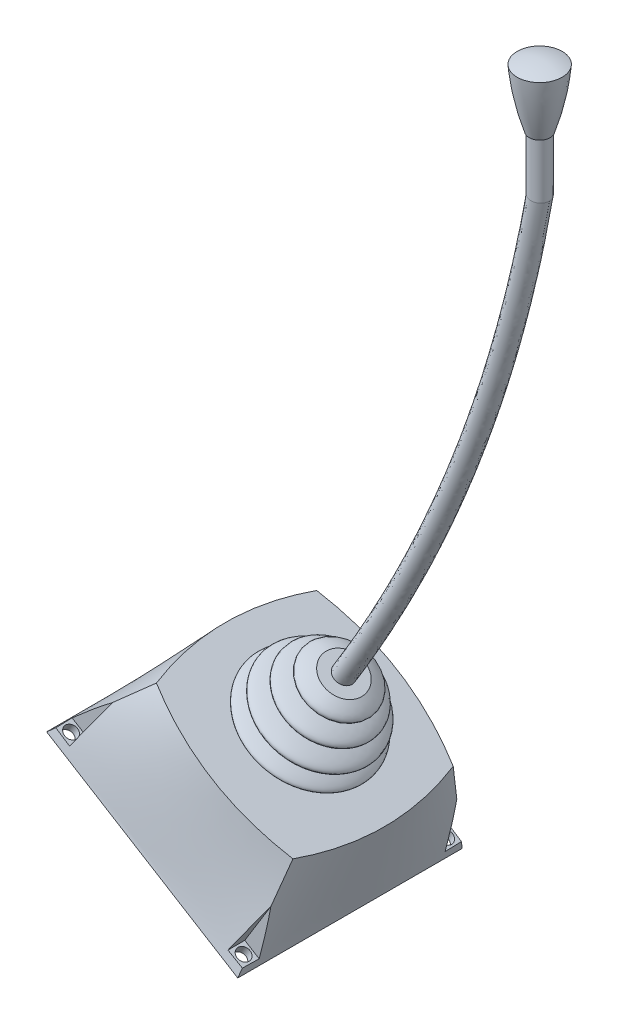
from build123d import *

# Parameters (mm, degrees)
SKETCH2_R          = 15
SKETCH10_W         = 30
SKETCH10_H         = 30
CUT_EXTRUDE1_DEPTH = 137.5
SKETCH12_W         = 10
SKETCH12_H         = 100
CIRPATTERN2_COUNT  = 4
SCALE2_SCALE       = 0.7


with BuildPart() as part:
    # Sweep1: sweep along a path in Sketch1
    with BuildLine() as sweep1_path:  # in the path sketch's own coordinates; laid on its plane below (add() does not lay a ready-made edge on the line's plane)
        Line((0, 25.731237744), (0, -89.384683846))
        add(Edge.make_bspline(
            [(0, -89.384683846), (-76.619317519, -517.816197766), (-305.28232105, -889.384683846)],
            knots=[0, 0, 0, 1, 1, 1], degree=2))
    # Sketch2 → Sweep1 (sweep)
    with BuildSketch(Plane(origin=(0, 25.731237744, 0), x_dir=(1, 0, 0), z_dir=(0, 1, 0))):
        Circle(SKETCH2_R)
    sweep(path=Plane.XY * sweep1_path.line, transition=Transition.RIGHT)

    # Sketch6 → Revolve4 (revolve)
    with BuildSketch(Plane.XY):
        with BuildLine():
            Line((-305.28232105, -889.384683846), (-277.675722749, -906.373766402))
            add(Edge.make_bspline(
                [(-277.675722749, -906.373766402), (-249.070910555, -940.147602219), (-289.199287868, -930.690561742)],
                knots=[0, 0, 0, 1, 1, 1], degree=2))
            add(Edge.make_bspline(
                [(-289.199287868, -930.690561742), (-239.648861973, -972.670827058), (-293.814928413, -963.230827581)],
                knots=[0, 0, 0, 1, 1, 1], degree=2))
            add(Edge.make_bspline(
                [(-293.814928413, -963.230827581), (-242.591086587, -1007.107299785), (-294.968838549, -997.38656761)],
                knots=[0, 0, 0, 1, 1, 1], degree=2))
            add(Edge.make_bspline(
                [(-294.968838549, -997.38656761), (-243.105190588, -1051.288372841), (-318.370546703, -1013.714881987), (-331.663180878, -1009.84879708)],
                knots=[0, 0, 0, 0, 1, 1, 1, 1], degree=3))
            Line((-331.663180878, -1009.84879708), (-366.298787064, -988.534067666))
            Line((-366.298787064, -988.534067666), (-305.28232105, -889.384683846))
        make_face()
    revolve(axis=Axis((-305.28232105, -889.384683846, 0), (-0.5241065254030228, -0.8516527167983265, 0)))

    # Sketch9 → Loft1 section 0
    with BuildSketch(Plane(origin=(-620.472581818, -1008.243809973, 0), x_dir=(-0.8516527167983268, 0.5241065254030226, 0), z_dir=(-0.5241065254030226, -0.8516527167983268, 0))):
        with BuildLine():
            Line((-381.137798284, 175), (-31.137798284, 175))
            Line((-31.137798284, 175), (-31.137798284, -175))
            Line((-31.137798284, -175), (-381.137798284, -175))
            Line((-381.137798284, -175), (-381.137798284, 175))
        make_face()
    # Sketch7 → Loft1 section 1
    with BuildSketch(Plane(origin=(-541.856603007, -880.495902453, 0), x_dir=(0.8516527167983268, -0.5241065254030226, 0), z_dir=(-0.5241065254030226, -0.8516527167983268, 0))):
        with BuildLine():
            add(Edge.make_bspline(
                [(81.137798284, 125), (206.137798284, 165.832368504), (331.137798284, 125)],
                knots=[0, 0, 0, 1, 1, 1], degree=2))
            add(Edge.make_bspline(
                [(331.137798284, 125), (371.970166789, 0), (331.137798284, -125)],
                knots=[0, 0, 0, 1, 1, 1], degree=2))
            add(Edge.make_bspline(
                [(331.137798284, -125), (206.137798284, -165.832368504), (81.137798284, -125)],
                knots=[0, 0, 0, 1, 1, 1], degree=2))
            add(Edge.make_bspline(
                [(81.137798284, -125), (40.30542978, 0), (81.137798284, 125)],
                knots=[0, 0, 0, 1, 1, 1], degree=2))
        make_face()
    loft()

    # Sketch10 → Cut-Extrude1 (cut)
    with BuildSketch(Plane(origin=(-541.856603007, -880.495902453, 0), x_dir=(0.8516527167983269, -0.5241065254030225, 0), z_dir=(0.5241065254030224, 0.8516527167983268, 0))):
        with Locations((366.137798284, 160)):
            Rectangle(SKETCH10_W, SKETCH10_H)
        with Locations((46.137798284, 160)):
            Rectangle(SKETCH10_W, SKETCH10_H)
        with Locations((46.137798284, -160)):
            Rectangle(SKETCH10_W, SKETCH10_H)
        with Locations((366.137798284, -160)):
            Rectangle(SKETCH10_W, SKETCH10_H)
    extrude(amount=-CUT_EXTRUDE1_DEPTH, mode=Mode.SUBTRACT)

    # Sketch12 → Hole1 (revolve, cut)
    with BuildSketch(Plane(origin=(-303.803034153, -1188.444698552, 157.9991439), x_dir=(-0.8516527167983265, 0.5241065254030227, 0), z_dir=(0, 0, 1))):
        with Locations((5, 50)):
            Rectangle(SKETCH12_W, SKETCH12_H)
    hole1 = revolve(axis=Axis((-361.454751948, -1282.126497399, 157.9991439), (0.5241065254030226, 0.8516527167983267, 0)), mode=Mode.SUBTRACT)

    # CirPattern2: Hole1 ×4 about axis
    cirpattern2_axis = Axis((175.557815944, -108.038165213, 0), (0.5241065254030227, 0.8516527167983265, 0))
    for i in range(1, CIRPATTERN2_COUNT):
        add(hole1.rotate(cirpattern2_axis, i * 360 / CIRPATTERN2_COUNT), mode=Mode.SUBTRACT)


with BuildPart() as body_2:
    # Sketch4 → Revolve3 (revolve)
    with BuildSketch(Plane.XY, mode=Mode.PRIVATE) as revolve3_sk:
        with BuildLine():
            add(Edge.make_bspline(
                [(0, 92.562829817), (17.5, 92.562829817), (35, 86.602143734)],
                knots=[0.5, 0.5, 0.5, 1, 1, 1], degree=2))
            add(Edge.make_bspline(
                [(16.496331619, -4.258044121), (31.065771721, 40.106678991), (35, 86.602143734)],
                knots=[0, 0, 0, 1, 1, 1], degree=2))
            Line((16.496331619, -4.258044121), (0, -4.258044121))
            Line((0, -4.258044121), (0, 92.562829817))
        make_face()
    revolve(revolve3_sk.sketch.rotate(Axis((0, 92.562829817, 0), (0, -1, 0)), 90), axis=Axis((0, 92.562829817, 0), (0, -1, 0)))


with BuildPart() as body_2_1:
    # Scale2: scaled about (0, 0, 0)
    add(body_2.part.scale(SCALE2_SCALE))


with BuildPart() as part_1:
    # Scale2: scaled about (0, 0, 0)
    add(part.part.scale(SCALE2_SCALE))


solid = Compound([body_2_1.part, part_1.part])
